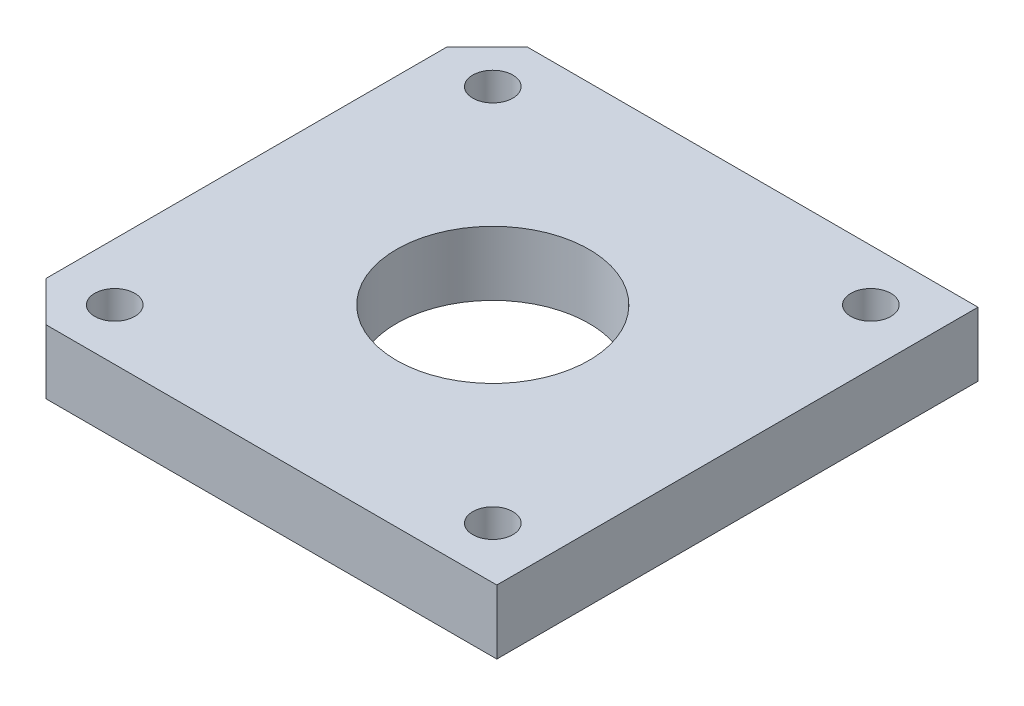
from build123d import *

# Parameters (mm, degrees)
SKETCH2_W          = 61.210230612
SKETCH2_H          = 60
EXTRUDE1_DEPTH     = 8
CHAMFER1_SIZE      = 5
SKETCH3_R          = 12
SKETCH3_R_2        = 2.5
CUT_EXTRUDE1_DEPTH = 53.63316445


with BuildPart() as part:
    # Sketch2 → Extrude1 (new body)
    with BuildSketch(Plane(origin=(0, 0, 0), x_dir=(1, 0, 0), z_dir=(0, 1, 0))):
        with Locations((11.894884694, 0)):
            Rectangle(SKETCH2_W, SKETCH2_H)
    extrude(amount=EXTRUDE1_DEPTH)

    # Chamfer1
    chamfer1_edges = [part.edges().sort_by_distance(p)[0] for p in [
        (-18.710230612, 4, 30),
        (-18.710230612, 4, -30),
    ]]
    chamfer(chamfer1_edges, length=CHAMFER1_SIZE)

    # Sketch3 → Cut-Extrude1 (cut, through all)
    with BuildSketch(Plane(origin=(0, 8, 0), x_dir=(1, 0, 0), z_dir=(0, 1, 0))):
        with Locations(Location((12, 0, 0), (0, 0, 270))):
            Circle(SKETCH3_R)
        with Locations(Location((-11.57, 23.57, 0), (0, 0, 270))):
            Circle(SKETCH3_R_2)
        with Locations(Location((35.57, 23.57, 0), (0, 0, 270))):
            Circle(SKETCH3_R_2)
        with Locations(Location((-11.57, -23.57, 0), (0, 0, 270))):
            Circle(SKETCH3_R_2)
        with Locations(Location((35.57, -23.57, 0), (0, 0, 270))):
            Circle(SKETCH3_R_2)
    extrude(amount=-CUT_EXTRUDE1_DEPTH, mode=Mode.SUBTRACT)


solid = part.part
